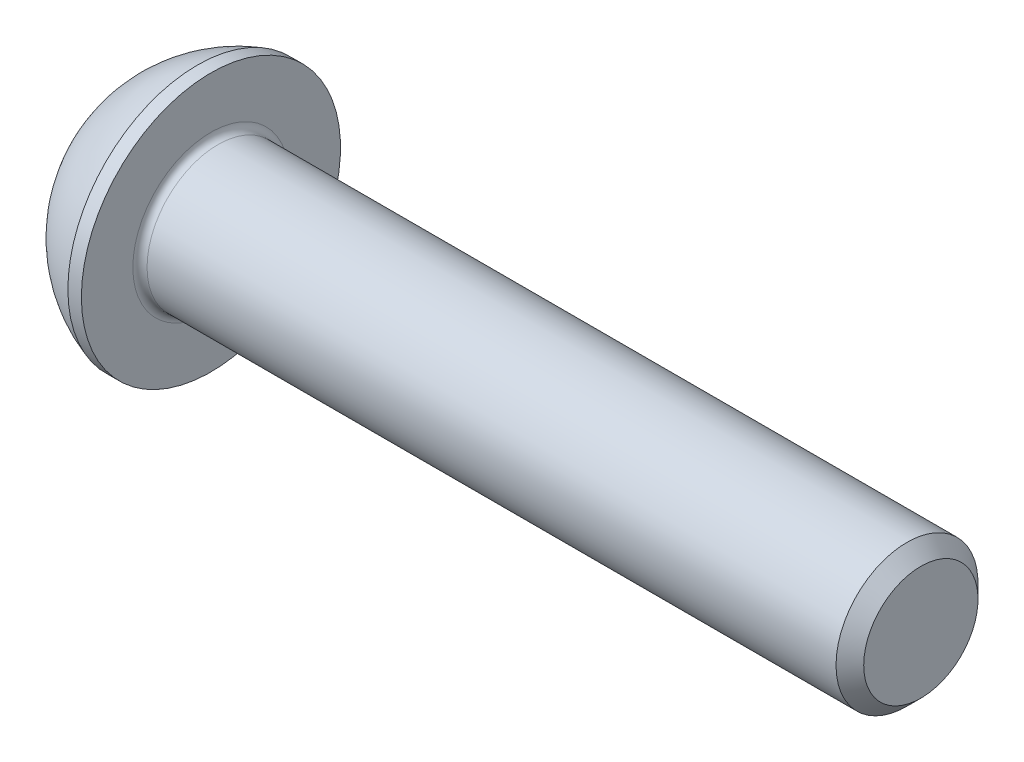
from build123d import *

# Parameters (mm, degrees)
FILLET1_R   = 0.2
HEX_2_DEPTH = 1.3


with BuildPart() as part:
    # BodySke → BaseBody (revolve)
    with BuildSketch(Plane.XY, mode=Mode.PRIVATE) as basebody_sk:
        with BuildLine():
            Line((22.6, 0), (22.6, 1.61))
            Line((22.6, 1.61), (22.21, 2))
            Line((22.21, 2), (2.6, 2))
            Line((2.6, 2), (2.6, 3.65))
            Line((2.6, 3.65), (2.22, 3.65))
            ThreePointArc((2.22, 3.65), (0.932036668, 2.953981423), (0, 1.825))
            Line((0, 1.825), (0, 0))
            Line((0, 0), (22.6, 0))
        make_face()
    revolve(basebody_sk.sketch.rotate(Axis((0, 0, 0), (1, 0, 0)), 90), axis=Axis((0, 0, 0), (1, 0, 0)))

    # Fillet1
    fillet1_edges = [part.edges().sort_by_distance(p)[0] for p in [
        (2.6, 0, -2),
    ]]
    fillet(fillet1_edges, radius=FILLET1_R)

    # Sketch2 → PreBroach (revolve, cut)
    with BuildSketch(Plane.XY, mode=Mode.PRIVATE) as prebroach_sk:
        Polygon((0, 1.25), (1.3, 1.25), (2.021687836, 0), (0, 0), align=None)
    revolve(prebroach_sk.sketch.rotate(Axis((0, 0, 0), (1, 0, 0)), 90), axis=Axis((0, 0, 0), (1, 0, 0)), mode=Mode.SUBTRACT)

    # Sketch3 → Hex 2 (cut)
    with BuildSketch(Plane(origin=(0, 0, 0), x_dir=(0, 0, -1), z_dir=(1, 0, 0))):
        Polygon((-1.25, -0.721687836), (-1.25, 0.721687836), (0, 1.443375673), (1.25, 0.721687836), (1.25, -0.721687836), (0, -1.443375673), align=None)
    extrude(amount=HEX_2_DEPTH, mode=Mode.SUBTRACT)


solid = part.part
